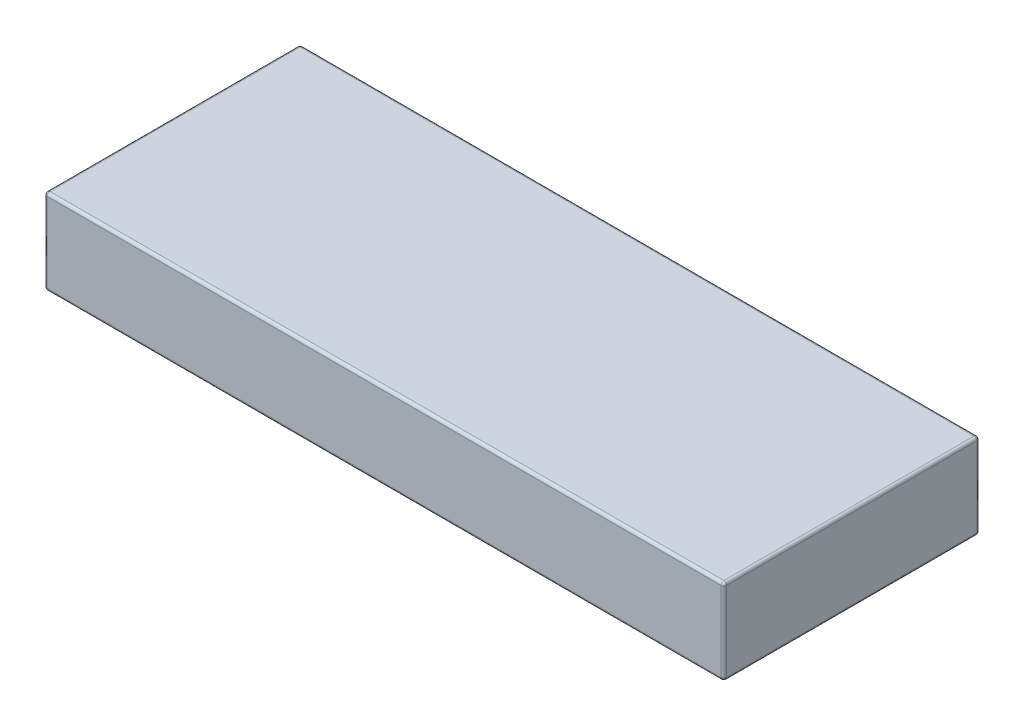
from build123d import *

# Parameters (mm, degrees)
SKETCH1_W           = 30.353
SKETCH1_H           = 11.43
BOSS_EXTRUDE1_DEPTH = 3.81
FILLET1_R           = 0.127


with BuildPart() as part:
    # Sketch1 → Boss-Extrude1 (new body)
    with BuildSketch(Plane(origin=(0, 0, 0), x_dir=(1, 0, 0), z_dir=(0, 1, 0))):
        with Locations((15.1765, 5.715)):
            Rectangle(SKETCH1_W, SKETCH1_H)
    extrude(amount=BOSS_EXTRUDE1_DEPTH)

    # Fillet1
    fillet1_edges = [part.edges().sort_by_distance(p)[0] for p in [
        (30.353, 3.81, -5.715),
        (15.1765, 3.81, -11.43),
        (0, 3.81, -5.715),
        (15.1765, 0, -11.43),
        (30.353, 0, -5.715),
        (15.1765, 0, 0),
        (0, 0, -5.715),
        (15.1765, 3.81, 0),
        (0, 1.905, -11.43),
        (30.353, 1.905, -11.43),
        (30.353, 1.905, 0),
        (0, 1.905, 0),
    ]]
    fillet(fillet1_edges, radius=FILLET1_R)


solid = part.part
